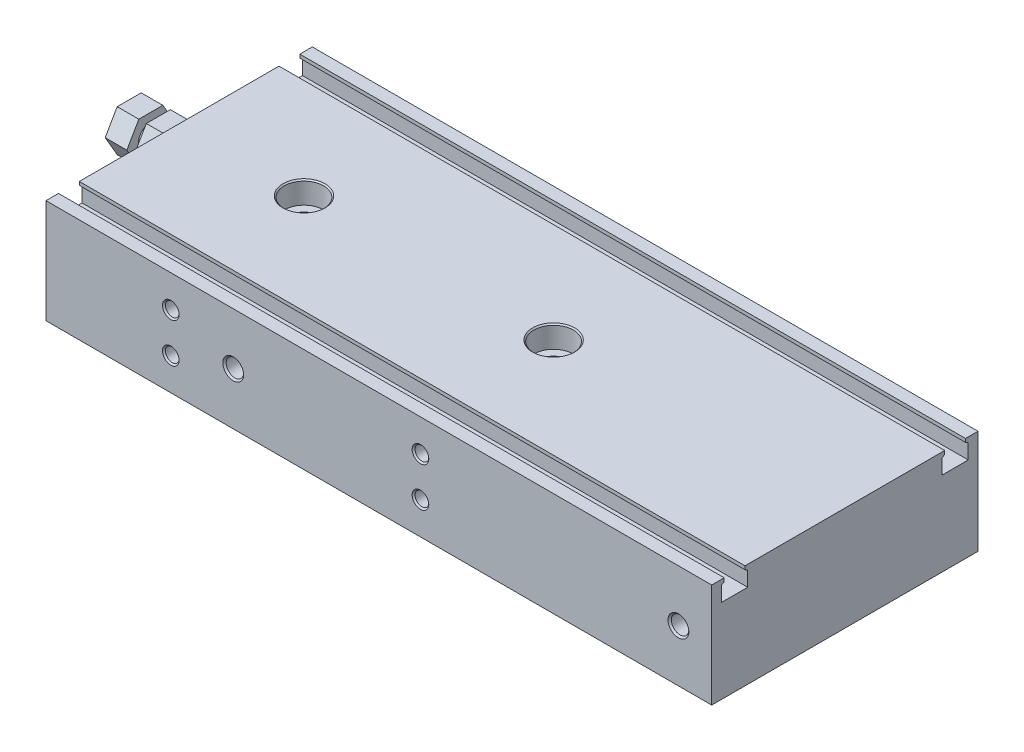
from build123d import *

# Parameters (mm, degrees)
BODY_SKETCH_W                                = 64
BODY_SKETCH_H                                = 25
BODY_DEPTH                                   = 160
BODY_ROD_HOLES_SKETCH_R                      = 5
BODY_ROD_HOLES_DEPTH                         = 10
BODY_PISTON_HOLES_SKETCH_R                   = 6.05
BODY_PISTON_HOLES_DEPTH                      = 91
TOP_SWITCH_GROOVES_DEPTH                     = 164.646723157
SHCS_MGT_HOLE_CHAM_SIZE                      = 0.3
SHCS_MGT_HOLE_PAT_COUNT                      = 2
SHCS_MGT_HOLE_PAT_PITCH                      = 60
SHCS_MGT_HOLE_CHAM_OF_SHCS_MGT_HOLE_PAT_SIZE = 0.3
SHCS_MGT_HOLE_BOT_TAP_AT_2_COUNT             = 2
SHCS_MGT_HOLE_BOT_TAP_AT_2_PITCH             = 60
ADJUSTER_NUT_DEPTH                           = 12
ADJUSTER_NUT_THREADS_SKETCH_W                = 1.8
ADJUSTER_NUT_THREADS_SKETCH_H                = 25
TAP_DRILL_FOR_M5X0_8_TAP1_D                  = 4.2
TAP_DRILL_FOR_M5X0_8_TAP1_DEPTH              = 4.5
TAP_DRILL_FOR_M5X0_8_TAP1_CSINK_D            = 5
TAP_DRILL_FOR_M5X0_8_TAP1_CSINK_ANGLE        = 90
TAP_DRILL_FOR_M5X0_8_TAP1_TIP                = 1.2618073
TAP_DRILL_FOR_M5X0_8_TAP2_D                  = 4.2
TAP_DRILL_FOR_M5X0_8_TAP2_DEPTH              = 4.5
TAP_DRILL_FOR_M5X0_8_TAP2_CSINK_D            = 5
TAP_DRILL_FOR_M5X0_8_TAP2_CSINK_ANGLE        = 90
TAP_DRILL_FOR_M5X0_8_TAP2_TIP                = 1.2618073
MOUNT_HOLES_1_D                              = 3.3
MOUNT_HOLES_1_DEPTH                          = 5.5
MOUNT_HOLES_1_CSINK_D                        = 4
MOUNT_HOLES_1_CSINK_ANGLE                    = 90
MOUNT_HOLES_1_TIP                            = 0.991420021
MOUNT_HOLES_2_D                              = 3.3
MOUNT_HOLES_2_DEPTH                          = 5.5
MOUNT_HOLES_2_CSINK_D                        = 4
MOUNT_HOLES_2_CSINK_ANGLE                    = 90
MOUNT_HOLES_2_TIP                            = 0.991420021
MOUNT_HOLES_3_D                              = 3.3
MOUNT_HOLES_3_DEPTH                          = 5.5
MOUNT_HOLES_3_CSINK_D                        = 4
MOUNT_HOLES_3_CSINK_ANGLE                    = 90
MOUNT_HOLES_3_TIP                            = 0.991420021
MOUNT_HOLES_4_D                              = 3.3
MOUNT_HOLES_4_DEPTH                          = 5.5
MOUNT_HOLES_4_CSINK_D                        = 4
MOUNT_HOLES_4_CSINK_ANGLE                    = 90
MOUNT_HOLES_4_TIP                            = 0.991420021


with BuildPart() as part:
    # Body_Sketch → Body (new body)
    with BuildSketch(Plane(origin=(0, 0, 0), x_dir=(0, 0, -1), z_dir=(1, 0, 0))):
        Rectangle(BODY_SKETCH_W, BODY_SKETCH_H)
    extrude(amount=BODY_DEPTH)

    # Body Rod Holes_Sketch → Body Rod Holes (cut)
    with BuildSketch(Plane.ZY):
        with Locations((-14, 0)):
            Circle(BODY_ROD_HOLES_SKETCH_R)
        with Locations(Location((14, 0, 0), (0, 0, 180))):
            Circle(BODY_ROD_HOLES_SKETCH_R)
    extrude(amount=-BODY_ROD_HOLES_DEPTH, mode=Mode.SUBTRACT)

    # Body Piston Holes_Sketch → Body Piston Holes (cut)
    with BuildSketch(Plane.ZY.offset(-10)):
        with Locations((14, 0)):
            Circle(BODY_PISTON_HOLES_SKETCH_R)
        with Locations((-14, 0)):
            Circle(BODY_PISTON_HOLES_SKETCH_R)
    extrude(amount=-BODY_PISTON_HOLES_DEPTH, mode=Mode.SUBTRACT)

    # Top Switch Grooves_Sketch → Top Switch Grooves (cut, through all)
    with BuildSketch(Plane.ZY):
        Polygon((23.35, 7.7), (29.65, 7.7), (29.65, 11.3), (29, 11.675277675), (29, 12.5), (24, 12.5), (24, 11.675277675), (23.35, 11.3), align=None)
        Polygon((-23.35, 11.3), (-23.35, 7.7), (-29.65, 7.7), (-29.65, 11.3), (-29, 11.675277675), (-29, 12.5), (-24, 12.5), (-24, 11.675277675), align=None)
    extrude(amount=-TOP_SWITCH_GROOVES_DEPTH, mode=Mode.SUBTRACT)

    # SHCS MGT Hole_Sketch → SHCS MGT Hole (revolve, cut)
    with BuildSketch(Plane.XY, mode=Mode.PRIVATE) as shcs_mgt_hole_sk:
        Polygon((30, 12.5), (25.25, 12.5), (25.25, 7.2), (27.25, 7.2), (27.25, -12.5), (30, -12.5), align=None)
    shcs_mgt_hole = revolve(shcs_mgt_hole_sk.sketch.rotate(Axis((30, -11.506886035, 0), (0, 1, 0)), 270), axis=Axis((30, -11.506886035, 0), (0, 1, 0)), mode=Mode.SUBTRACT)

    # SHCS MGT Hole Cham
    shcs_mgt_hole_cham_edges = [part.edges().sort_by_distance(p)[0] for p in [
        (30, 12.5, 4.75),
    ]]
    chamfer(shcs_mgt_hole_cham_edges, length=SHCS_MGT_HOLE_CHAM_SIZE)

    # SHCS MGT Hole Pat: SHCS MGT Hole ×2
    with Locations(*[(i * SHCS_MGT_HOLE_PAT_PITCH, 0, 0) for i in range(1, SHCS_MGT_HOLE_PAT_COUNT)]):
        add(shcs_mgt_hole, mode=Mode.SUBTRACT)

    # SHCS MGT Hole Cham of SHCS MGT Hole Pat
    shcs_mgt_hole_cham_of_shcs_mgt_hole_pat_edges = [part.edges().sort_by_distance(p)[0] for p in [
        (90, 12.5, 4.75),
    ]]
    chamfer(shcs_mgt_hole_cham_of_shcs_mgt_hole_pat_edges, length=SHCS_MGT_HOLE_CHAM_OF_SHCS_MGT_HOLE_PAT_SIZE)

    # SHCS MGT Hole Bot Tap Profile → SHCS MGT Hole Bot Tap (revolve, cut)
    with BuildSketch(Plane(origin=(30, -12.5, 0), x_dir=(0, 0, -1), z_dir=(1, 0, 0))):
        Polygon((0, 0), (0, 12.652366702), (2.75, 11), (2.75, 10), (3, 10), (3, 0.3), (3.3, 0), align=None)
    shcs_mgt_hole_bot_tap = revolve(axis=Axis((30, -18.85, 0), (0, 1, 0)), mode=Mode.SUBTRACT)

    # SHCS MGT Hole Bot Tap at 2: SHCS MGT Hole Bot Tap ×2
    with Locations(*[(i * SHCS_MGT_HOLE_BOT_TAP_AT_2_PITCH, 0, 0) for i in range(1, SHCS_MGT_HOLE_BOT_TAP_AT_2_COUNT)]):
        add(shcs_mgt_hole_bot_tap, mode=Mode.SUBTRACT)

    # Adjuster Nut_Sketch → Adjuster Nut (add)
    with BuildSketch(Plane.ZY):
        Polygon((-2.886751346, 11.5), (2.886751346, 11.5), (5.773502692, 6.5), (2.886751346, 1.5), (-2.886751346, 1.5), (-5.773502692, 6.5), align=None)
    extrude(amount=ADJUSTER_NUT_DEPTH)

    # Adjuster Nut Threads_Sketch → Adjuster Nut Threads (revolve, cut)
    with BuildSketch(Plane.XY, mode=Mode.PRIVATE) as adjuster_nut_threads_sk:
        with Locations((-5.9, 22)):
            Rectangle(ADJUSTER_NUT_THREADS_SKETCH_W, ADJUSTER_NUT_THREADS_SKETCH_H)
    revolve(adjuster_nut_threads_sk.sketch.rotate(Axis((-6.476, 6.5, 0), (1, 0, 0)), 270), axis=Axis((-6.476, 6.5, 0), (1, 0, 0)), mode=Mode.SUBTRACT)

    # Tap Drill for M5x0.8 Tap1
    with Locations(Plane.XY.offset(32)):
        with Locations((45, 0), (152, 0)):
            CounterSinkHole(TAP_DRILL_FOR_M5X0_8_TAP1_D / 2, TAP_DRILL_FOR_M5X0_8_TAP1_CSINK_D / 2, depth=TAP_DRILL_FOR_M5X0_8_TAP1_DEPTH, counter_sink_angle=TAP_DRILL_FOR_M5X0_8_TAP1_CSINK_ANGLE)
            with Locations((0, 0, -(TAP_DRILL_FOR_M5X0_8_TAP1_DEPTH + TAP_DRILL_FOR_M5X0_8_TAP1_TIP / 2))):  # 118° drill point
                Cone(0, TAP_DRILL_FOR_M5X0_8_TAP1_D / 2, TAP_DRILL_FOR_M5X0_8_TAP1_TIP, mode=Mode.SUBTRACT)

    # Tap Drill for M5x0.8 Tap2
    with Locations(Plane(origin=(0, 0, -32), x_dir=(-1, 0, 0), z_dir=(0, 0, -1))):
        with Locations((-152, 0), (-45, 0)):
            CounterSinkHole(TAP_DRILL_FOR_M5X0_8_TAP2_D / 2, TAP_DRILL_FOR_M5X0_8_TAP2_CSINK_D / 2, depth=TAP_DRILL_FOR_M5X0_8_TAP2_DEPTH, counter_sink_angle=TAP_DRILL_FOR_M5X0_8_TAP2_CSINK_ANGLE)
            with Locations((0, 0, -(TAP_DRILL_FOR_M5X0_8_TAP2_DEPTH + TAP_DRILL_FOR_M5X0_8_TAP2_TIP / 2))):  # 118° drill point
                Cone(0, TAP_DRILL_FOR_M5X0_8_TAP2_D / 2, TAP_DRILL_FOR_M5X0_8_TAP2_TIP, mode=Mode.SUBTRACT)

    # Mount_Holes_1
    with Locations(Plane.XY.offset(32)):
        with Locations((30, -4.75), (90, -4.75)):
            CounterSinkHole(MOUNT_HOLES_1_D / 2, MOUNT_HOLES_1_CSINK_D / 2, depth=MOUNT_HOLES_1_DEPTH, counter_sink_angle=MOUNT_HOLES_1_CSINK_ANGLE)
            with Locations((0, 0, -(MOUNT_HOLES_1_DEPTH + MOUNT_HOLES_1_TIP / 2))):  # 118° drill point
                Cone(0, MOUNT_HOLES_1_D / 2, MOUNT_HOLES_1_TIP, mode=Mode.SUBTRACT)

    # Mount_Holes_2
    with Locations(Plane(origin=(0, 0, -32), x_dir=(-1, 0, 0), z_dir=(0, 0, -1))):
        with Locations((-90, -4.75), (-30, -4.75)):
            CounterSinkHole(MOUNT_HOLES_2_D / 2, MOUNT_HOLES_2_CSINK_D / 2, depth=MOUNT_HOLES_2_DEPTH, counter_sink_angle=MOUNT_HOLES_2_CSINK_ANGLE)
            with Locations((0, 0, -(MOUNT_HOLES_2_DEPTH + MOUNT_HOLES_2_TIP / 2))):  # 118° drill point
                Cone(0, MOUNT_HOLES_2_D / 2, MOUNT_HOLES_2_TIP, mode=Mode.SUBTRACT)

    # Mount_Holes_3
    with Locations(Plane.XY.offset(32)):
        with Locations((30, 4.75), (90, 4.75)):
            CounterSinkHole(MOUNT_HOLES_3_D / 2, MOUNT_HOLES_3_CSINK_D / 2, depth=MOUNT_HOLES_3_DEPTH, counter_sink_angle=MOUNT_HOLES_3_CSINK_ANGLE)
            with Locations((0, 0, -(MOUNT_HOLES_3_DEPTH + MOUNT_HOLES_3_TIP / 2))):  # 118° drill point
                Cone(0, MOUNT_HOLES_3_D / 2, MOUNT_HOLES_3_TIP, mode=Mode.SUBTRACT)

    # Mount_Holes_4
    with Locations(Plane(origin=(0, 0, -32), x_dir=(-1, 0, 0), z_dir=(0, 0, -1))):
        with Locations((-90, 4.75), (-30, 4.75)):
            CounterSinkHole(MOUNT_HOLES_4_D / 2, MOUNT_HOLES_4_CSINK_D / 2, depth=MOUNT_HOLES_4_DEPTH, counter_sink_angle=MOUNT_HOLES_4_CSINK_ANGLE)
            with Locations((0, 0, -(MOUNT_HOLES_4_DEPTH + MOUNT_HOLES_4_TIP / 2))):  # 118° drill point
                Cone(0, MOUNT_HOLES_4_D / 2, MOUNT_HOLES_4_TIP, mode=Mode.SUBTRACT)


solid = part.part
